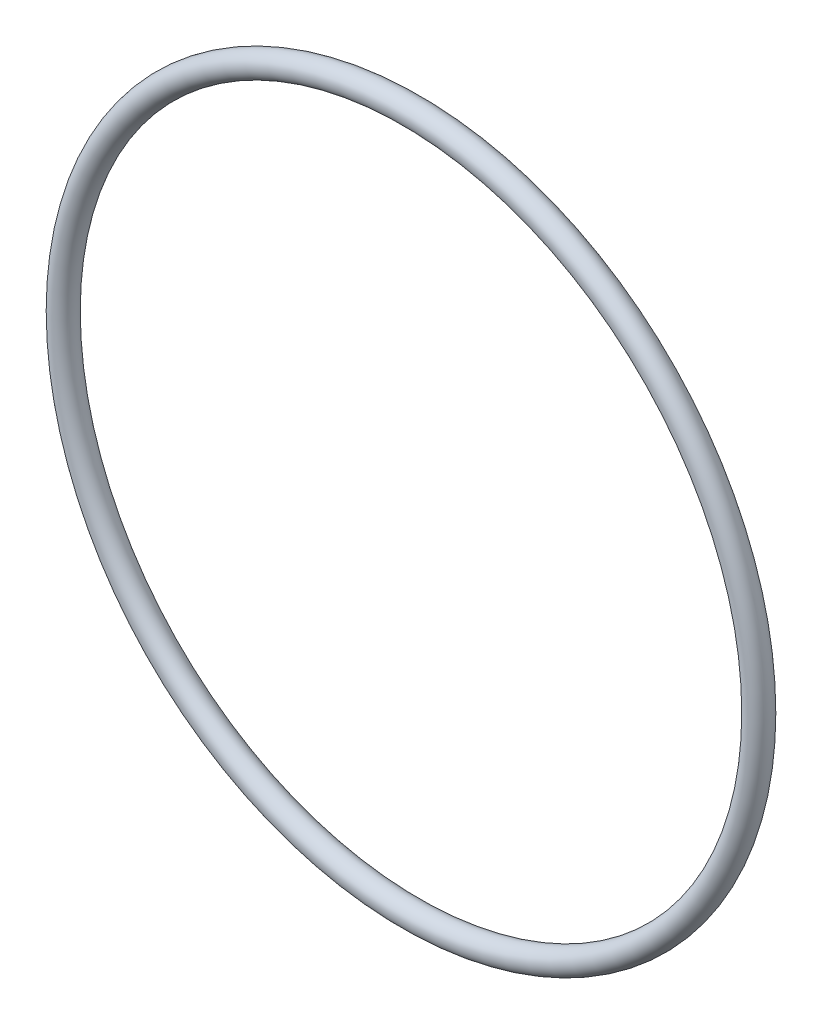
from build123d import *

# Parameters (mm, degrees)
SKETCH1_R = 2.667


with BuildPart() as part:
    # Sketch1 → Revolve1 (revolve)
    with BuildSketch(Plane(origin=(0, 0, 0), x_dir=(0, -1, 0), z_dir=(1, 0, 0)), mode=Mode.PRIVATE) as revolve1_sk:
        with Locations((76.962, 0)):
            Circle(SKETCH1_R)
    revolve(revolve1_sk.sketch.rotate(Axis((0, 0, 2.667), (0, 0, -1)), 270), axis=Axis((0, 0, 2.667), (0, 0, -1)))


solid = part.part
